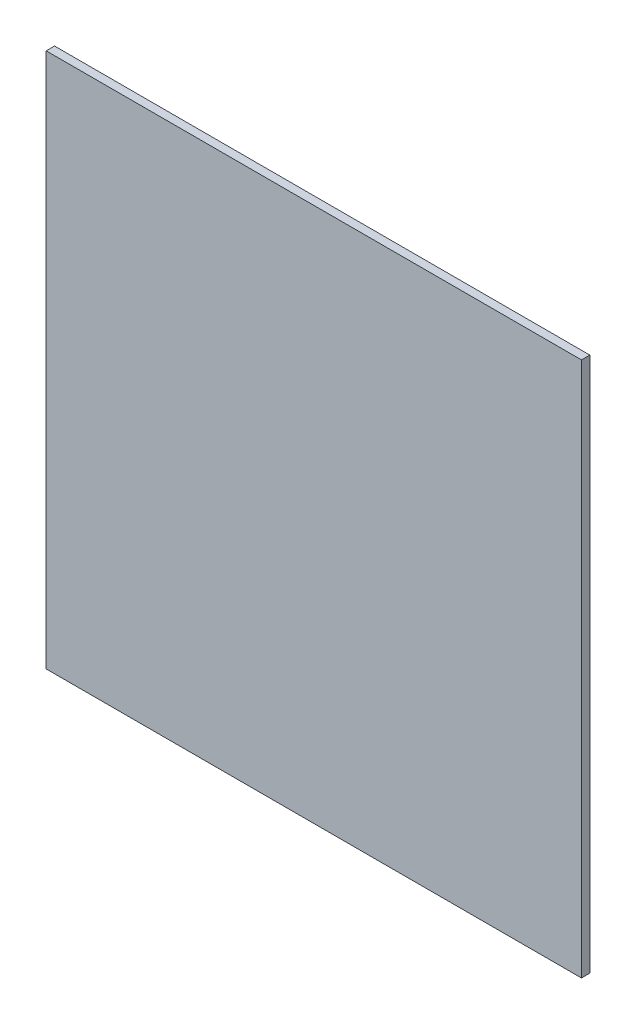
from build123d import *

# Parameters (mm, degrees)
SKETCH1_W           = 1219.2
SKETCH1_H           = 1219.2
BOSS_EXTRUDE1_DEPTH = 19.05


with BuildPart() as part:
    # Sketch1 → Boss-Extrude1 (new body)
    with BuildSketch(Plane.XY):
        Rectangle(SKETCH1_W, SKETCH1_H)
    extrude(amount=BOSS_EXTRUDE1_DEPTH)


solid = part.part
